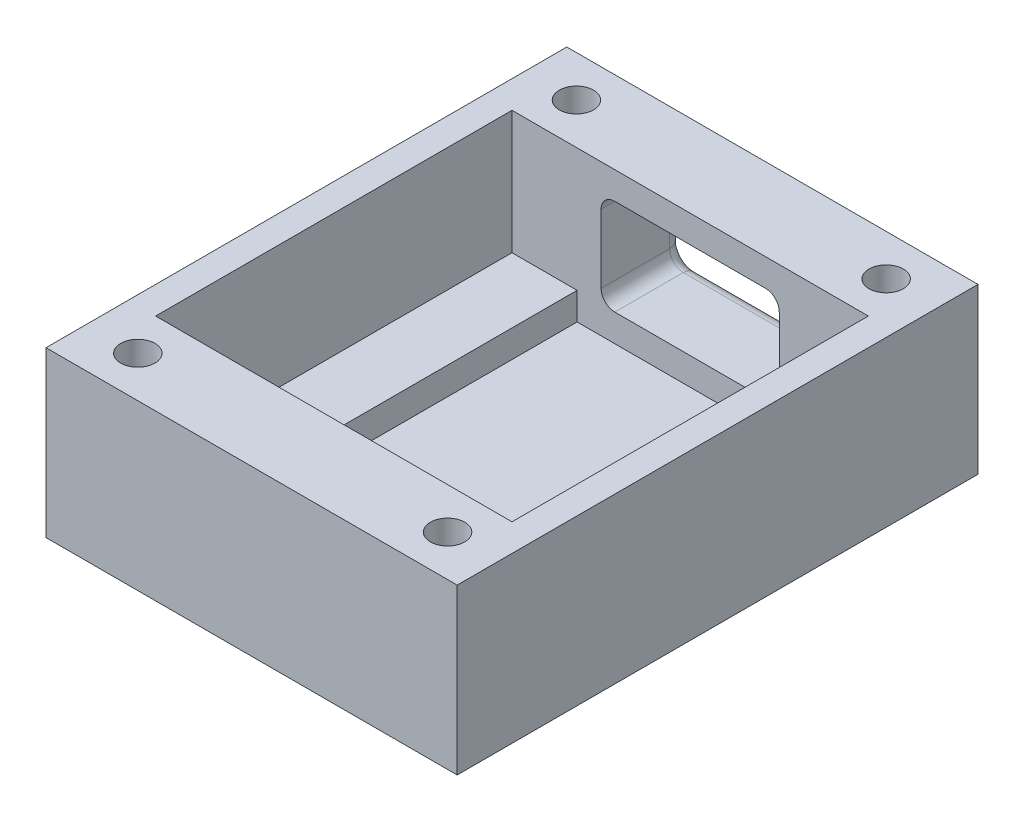
from build123d import *

# Parameters (mm, degrees)
SKETCH_1_W          = 30
SKETCH_1_H          = 38
EXTRUDE_1_DEPTH     = 12
CUT_EXTRUDE_START   = 3
SKETCH_1_4_W        = 26
SKETCH_1_4_H        = 26
CUT_EXTRUDE_1_DEPTH = 14
SKETCH_1_6_W        = 16.5
SKETCH_1_6_H        = 26
CUT_EXTRUDE_2_DEPTH = 2
SKETCH_1_7_R        = 1.25
CUT_EXTRUDE_5_DEPTH = 21
SKETCH_1_8_R        = 2.25
CUT_EXTRUDE_6_DEPTH = 5
SKETCH_3_W          = 13
SKETCH_3_H          = 7
CUT_EXTRUDE_7_DEPTH = 7
FILLET_1_R          = 1
FILLET_2_R          = 1


with BuildPart() as part:
    # 草图1 → 凸台-拉伸1 (new body)
    with BuildSketch(Plane(origin=(0, 0, 0), x_dir=(1, 0, 0), z_dir=(0, 1, 0))):
        Rectangle(SKETCH_1_W, SKETCH_1_H)
    extrude(amount=EXTRUDE_1_DEPTH)

    # 草图1<4> → 切除-拉伸1 (cut)
    with BuildSketch(Plane(origin=(0, 0, 0), x_dir=(1, 0, 0), z_dir=(0, 1, 0)).offset(CUT_EXTRUDE_START)):
        Rectangle(SKETCH_1_4_W, SKETCH_1_4_H)
    extrude(amount=CUT_EXTRUDE_1_DEPTH, mode=Mode.SUBTRACT)

    # 草图1<6> → 切除-拉伸2 (cut)
    with BuildSketch(Plane(origin=(0, 0, 0), x_dir=(1, 0, 0), z_dir=(0, 1, 0)).offset(CUT_EXTRUDE_START)):
        Rectangle(SKETCH_1_6_W, SKETCH_1_6_H)
    extrude(amount=-CUT_EXTRUDE_2_DEPTH, mode=Mode.SUBTRACT)

    # 草图1<7> → 切除-拉伸5 (cut)
    with BuildSketch(Plane(origin=(0, 0, 0), x_dir=(1, 0, 0), z_dir=(0, 1, 0))):
        with Locations(Location((-11.3, 16, 0), (0, 0, 90))):
            Circle(SKETCH_1_7_R)
        with Locations(Location((11.3, 16, 0), (0, 0, 90))):
            Circle(SKETCH_1_7_R)
        with Locations(Location((11.3, -16, 0), (0, 0, 90))):
            Circle(SKETCH_1_7_R)
        with Locations(Location((-11.3, -16, 0), (0, 0, 90))):
            Circle(SKETCH_1_7_R)
    extrude(amount=CUT_EXTRUDE_5_DEPTH, mode=Mode.SUBTRACT)

    # 草图1<8> → 切除-拉伸6 (cut)
    with BuildSketch(Plane(origin=(0, 0, 0), x_dir=(1, 0, 0), z_dir=(0, 1, 0))):
        with Locations(Location((-11.3, 16, 0), (0, 0, 270))):
            Circle(SKETCH_1_8_R)
        with Locations(Location((11.3, 16, 0), (0, 0, 90))):
            Circle(SKETCH_1_8_R)
        with Locations(Location((11.3, -16, 0), (0, 0, 270))):
            Circle(SKETCH_1_8_R)
        with Locations(Location((-11.3, -16, 0), (0, 0, 90))):
            Circle(SKETCH_1_8_R)
    extrude(amount=CUT_EXTRUDE_6_DEPTH, mode=Mode.SUBTRACT)

    # 草图3 → 切除-拉伸7 (cut)
    with BuildSketch(Plane.XY.offset(-19)):
        with Locations((0, 6.5)):
            Rectangle(SKETCH_3_W, SKETCH_3_H)
    extrude(amount=CUT_EXTRUDE_7_DEPTH, mode=Mode.SUBTRACT)

    # 圆角1
    fillet_1_edges = [part.edges().sort_by_distance(p)[0] for p in [
        (6.5, 3, -16),
        (6.5, 10, -16),
        (-6.5, 10, -16),
        (-6.5, 3, -16),
    ]]
    fillet(fillet_1_edges, radius=FILLET_1_R)

    # 圆角2
    fillet_2_edges = [part.edges().sort_by_distance(p)[0] for p in [
        (0, 3, -19),
        (6.5, 6.5, -19),
        (0, 10, -19),
        (-6.5, 6.5, -19),
        (6.207106781, 3.292893219, -19),
        (6.207106781, 9.707106781, -19),
        (-6.207106781, 9.707106781, -19),
        (-6.207106781, 3.292893219, -19),
    ]]
    fillet(fillet_2_edges, radius=FILLET_2_R)


solid = part.part
